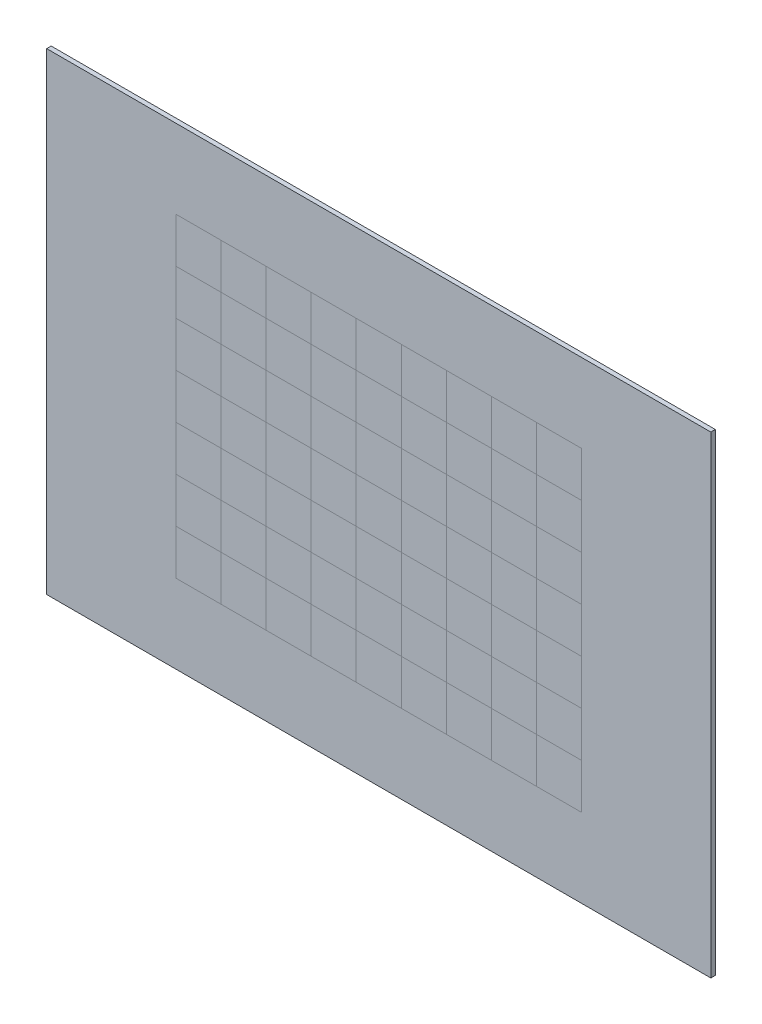
from build123d import *

# Parameters (mm, degrees)
SKETCH1_W           = 100
SKETCH1_H           = 100
BOSS_EXTRUDE1_DEPTH = 10
LPATTERN1_COUNT     = 9
LPATTERN1_PITCH     = 100
LPATTERN1_2_COUNT   = 7
LPATTERN1_2_PITCH   = 100
SKETCH2_W           = 1475
SKETCH2_H           = 1050
SKETCH2_W_2         = 900
SKETCH2_H_2         = 700
BOSS_EXTRUDE2_DEPTH = 10


with BuildPart() as part:
    # Sketch1 → Boss-Extrude1 (new body)
    with BuildSketch(Plane.XY):
        with Locations((50, -50)):
            Rectangle(SKETCH1_W, SKETCH1_H)
    extrude(amount=BOSS_EXTRUDE1_DEPTH)


with BuildPart() as lpattern1_1:
    # LPattern1: pattern copy
    add(part.part.moved(Location(Vector(1, 0, 0) * (1 * LPATTERN1_PITCH))))


with BuildPart() as lpattern1_2:
    # LPattern1: pattern copy
    add(part.part.moved(Location(Vector(1, 0, 0) * (2 * LPATTERN1_PITCH))))


with BuildPart() as lpattern1_3:
    # LPattern1: pattern copy
    add(part.part.moved(Location(Vector(1, 0, 0) * (3 * LPATTERN1_PITCH))))


with BuildPart() as lpattern1_4:
    # LPattern1: pattern copy
    add(part.part.moved(Location(Vector(1, 0, 0) * (4 * LPATTERN1_PITCH))))


with BuildPart() as lpattern1_5:
    # LPattern1: pattern copy
    add(part.part.moved(Location(Vector(1, 0, 0) * (5 * LPATTERN1_PITCH))))


with BuildPart() as lpattern1_6:
    # LPattern1: pattern copy
    add(part.part.moved(Location(Vector(1, 0, 0) * (6 * LPATTERN1_PITCH))))


with BuildPart() as lpattern1_7:
    # LPattern1: pattern copy
    add(part.part.moved(Location(Vector(1, 0, 0) * (7 * LPATTERN1_PITCH))))


with BuildPart() as lpattern1_8:
    # LPattern1: pattern copy
    add(part.part.moved(Location(Vector(1, 0, 0) * (8 * LPATTERN1_PITCH))))


with BuildPart() as lpattern1_2_1:
    # LPattern1 2: pattern copy
    add(part.part.moved(Location(Vector(0, -1, 0) * (1 * LPATTERN1_2_PITCH))))


with BuildPart() as lpattern1_2_2:
    # LPattern1 2: pattern copy
    add(part.part.moved(Location(Vector(0, -1, 0) * (2 * LPATTERN1_2_PITCH))))


with BuildPart() as lpattern1_2_3:
    # LPattern1 2: pattern copy
    add(part.part.moved(Location(Vector(0, -1, 0) * (3 * LPATTERN1_2_PITCH))))


with BuildPart() as lpattern1_2_4:
    # LPattern1 2: pattern copy
    add(part.part.moved(Location(Vector(0, -1, 0) * (4 * LPATTERN1_2_PITCH))))


with BuildPart() as lpattern1_2_5:
    # LPattern1 2: pattern copy
    add(part.part.moved(Location(Vector(0, -1, 0) * (5 * LPATTERN1_2_PITCH))))


with BuildPart() as lpattern1_2_6:
    # LPattern1 2: pattern copy
    add(part.part.moved(Location(Vector(0, -1, 0) * (6 * LPATTERN1_2_PITCH))))


with BuildPart() as lpattern1_2_7:
    # LPattern1 2: pattern copy
    add(lpattern1_1.part.moved(Location(Vector(0, -1, 0) * (1 * LPATTERN1_2_PITCH))))


with BuildPart() as lpattern1_2_8:
    # LPattern1 2: pattern copy
    add(lpattern1_1.part.moved(Location(Vector(0, -1, 0) * (2 * LPATTERN1_2_PITCH))))


with BuildPart() as lpattern1_2_9:
    # LPattern1 2: pattern copy
    add(lpattern1_1.part.moved(Location(Vector(0, -1, 0) * (3 * LPATTERN1_2_PITCH))))


with BuildPart() as lpattern1_2_10:
    # LPattern1 2: pattern copy
    add(lpattern1_1.part.moved(Location(Vector(0, -1, 0) * (4 * LPATTERN1_2_PITCH))))


with BuildPart() as lpattern1_2_11:
    # LPattern1 2: pattern copy
    add(lpattern1_1.part.moved(Location(Vector(0, -1, 0) * (5 * LPATTERN1_2_PITCH))))


with BuildPart() as lpattern1_2_12:
    # LPattern1 2: pattern copy
    add(lpattern1_1.part.moved(Location(Vector(0, -1, 0) * (6 * LPATTERN1_2_PITCH))))


with BuildPart() as lpattern1_2_13:
    # LPattern1 2: pattern copy
    add(lpattern1_2.part.moved(Location(Vector(0, -1, 0) * (1 * LPATTERN1_2_PITCH))))


with BuildPart() as lpattern1_2_14:
    # LPattern1 2: pattern copy
    add(lpattern1_2.part.moved(Location(Vector(0, -1, 0) * (2 * LPATTERN1_2_PITCH))))


with BuildPart() as lpattern1_2_15:
    # LPattern1 2: pattern copy
    add(lpattern1_2.part.moved(Location(Vector(0, -1, 0) * (3 * LPATTERN1_2_PITCH))))


with BuildPart() as lpattern1_2_16:
    # LPattern1 2: pattern copy
    add(lpattern1_2.part.moved(Location(Vector(0, -1, 0) * (4 * LPATTERN1_2_PITCH))))


with BuildPart() as lpattern1_2_17:
    # LPattern1 2: pattern copy
    add(lpattern1_2.part.moved(Location(Vector(0, -1, 0) * (5 * LPATTERN1_2_PITCH))))


with BuildPart() as lpattern1_2_18:
    # LPattern1 2: pattern copy
    add(lpattern1_2.part.moved(Location(Vector(0, -1, 0) * (6 * LPATTERN1_2_PITCH))))


with BuildPart() as lpattern1_2_19:
    # LPattern1 2: pattern copy
    add(lpattern1_3.part.moved(Location(Vector(0, -1, 0) * (1 * LPATTERN1_2_PITCH))))


with BuildPart() as lpattern1_2_20:
    # LPattern1 2: pattern copy
    add(lpattern1_3.part.moved(Location(Vector(0, -1, 0) * (2 * LPATTERN1_2_PITCH))))


with BuildPart() as lpattern1_2_21:
    # LPattern1 2: pattern copy
    add(lpattern1_3.part.moved(Location(Vector(0, -1, 0) * (3 * LPATTERN1_2_PITCH))))


with BuildPart() as lpattern1_2_22:
    # LPattern1 2: pattern copy
    add(lpattern1_3.part.moved(Location(Vector(0, -1, 0) * (4 * LPATTERN1_2_PITCH))))


with BuildPart() as lpattern1_2_23:
    # LPattern1 2: pattern copy
    add(lpattern1_3.part.moved(Location(Vector(0, -1, 0) * (5 * LPATTERN1_2_PITCH))))


with BuildPart() as lpattern1_2_24:
    # LPattern1 2: pattern copy
    add(lpattern1_3.part.moved(Location(Vector(0, -1, 0) * (6 * LPATTERN1_2_PITCH))))


with BuildPart() as lpattern1_2_25:
    # LPattern1 2: pattern copy
    add(lpattern1_4.part.moved(Location(Vector(0, -1, 0) * (1 * LPATTERN1_2_PITCH))))


with BuildPart() as lpattern1_2_26:
    # LPattern1 2: pattern copy
    add(lpattern1_4.part.moved(Location(Vector(0, -1, 0) * (2 * LPATTERN1_2_PITCH))))


with BuildPart() as lpattern1_2_27:
    # LPattern1 2: pattern copy
    add(lpattern1_4.part.moved(Location(Vector(0, -1, 0) * (3 * LPATTERN1_2_PITCH))))


with BuildPart() as lpattern1_2_28:
    # LPattern1 2: pattern copy
    add(lpattern1_4.part.moved(Location(Vector(0, -1, 0) * (4 * LPATTERN1_2_PITCH))))


with BuildPart() as lpattern1_2_29:
    # LPattern1 2: pattern copy
    add(lpattern1_4.part.moved(Location(Vector(0, -1, 0) * (5 * LPATTERN1_2_PITCH))))


with BuildPart() as lpattern1_2_30:
    # LPattern1 2: pattern copy
    add(lpattern1_4.part.moved(Location(Vector(0, -1, 0) * (6 * LPATTERN1_2_PITCH))))


with BuildPart() as lpattern1_2_31:
    # LPattern1 2: pattern copy
    add(lpattern1_5.part.moved(Location(Vector(0, -1, 0) * (1 * LPATTERN1_2_PITCH))))


with BuildPart() as lpattern1_2_32:
    # LPattern1 2: pattern copy
    add(lpattern1_5.part.moved(Location(Vector(0, -1, 0) * (2 * LPATTERN1_2_PITCH))))


with BuildPart() as lpattern1_2_33:
    # LPattern1 2: pattern copy
    add(lpattern1_5.part.moved(Location(Vector(0, -1, 0) * (3 * LPATTERN1_2_PITCH))))


with BuildPart() as lpattern1_2_34:
    # LPattern1 2: pattern copy
    add(lpattern1_5.part.moved(Location(Vector(0, -1, 0) * (4 * LPATTERN1_2_PITCH))))


with BuildPart() as lpattern1_2_35:
    # LPattern1 2: pattern copy
    add(lpattern1_5.part.moved(Location(Vector(0, -1, 0) * (5 * LPATTERN1_2_PITCH))))


with BuildPart() as lpattern1_2_36:
    # LPattern1 2: pattern copy
    add(lpattern1_5.part.moved(Location(Vector(0, -1, 0) * (6 * LPATTERN1_2_PITCH))))


with BuildPart() as lpattern1_2_37:
    # LPattern1 2: pattern copy
    add(lpattern1_6.part.moved(Location(Vector(0, -1, 0) * (1 * LPATTERN1_2_PITCH))))


with BuildPart() as lpattern1_2_38:
    # LPattern1 2: pattern copy
    add(lpattern1_6.part.moved(Location(Vector(0, -1, 0) * (2 * LPATTERN1_2_PITCH))))


with BuildPart() as lpattern1_2_39:
    # LPattern1 2: pattern copy
    add(lpattern1_6.part.moved(Location(Vector(0, -1, 0) * (3 * LPATTERN1_2_PITCH))))


with BuildPart() as lpattern1_2_40:
    # LPattern1 2: pattern copy
    add(lpattern1_6.part.moved(Location(Vector(0, -1, 0) * (4 * LPATTERN1_2_PITCH))))


with BuildPart() as lpattern1_2_41:
    # LPattern1 2: pattern copy
    add(lpattern1_6.part.moved(Location(Vector(0, -1, 0) * (5 * LPATTERN1_2_PITCH))))


with BuildPart() as lpattern1_2_42:
    # LPattern1 2: pattern copy
    add(lpattern1_6.part.moved(Location(Vector(0, -1, 0) * (6 * LPATTERN1_2_PITCH))))


with BuildPart() as lpattern1_2_43:
    # LPattern1 2: pattern copy
    add(lpattern1_7.part.moved(Location(Vector(0, -1, 0) * (1 * LPATTERN1_2_PITCH))))


with BuildPart() as lpattern1_2_44:
    # LPattern1 2: pattern copy
    add(lpattern1_7.part.moved(Location(Vector(0, -1, 0) * (2 * LPATTERN1_2_PITCH))))


with BuildPart() as lpattern1_2_45:
    # LPattern1 2: pattern copy
    add(lpattern1_7.part.moved(Location(Vector(0, -1, 0) * (3 * LPATTERN1_2_PITCH))))


with BuildPart() as lpattern1_2_46:
    # LPattern1 2: pattern copy
    add(lpattern1_7.part.moved(Location(Vector(0, -1, 0) * (4 * LPATTERN1_2_PITCH))))


with BuildPart() as lpattern1_2_47:
    # LPattern1 2: pattern copy
    add(lpattern1_7.part.moved(Location(Vector(0, -1, 0) * (5 * LPATTERN1_2_PITCH))))


with BuildPart() as lpattern1_2_48:
    # LPattern1 2: pattern copy
    add(lpattern1_7.part.moved(Location(Vector(0, -1, 0) * (6 * LPATTERN1_2_PITCH))))


with BuildPart() as lpattern1_2_49:
    # LPattern1 2: pattern copy
    add(lpattern1_8.part.moved(Location(Vector(0, -1, 0) * (1 * LPATTERN1_2_PITCH))))


with BuildPart() as lpattern1_2_50:
    # LPattern1 2: pattern copy
    add(lpattern1_8.part.moved(Location(Vector(0, -1, 0) * (2 * LPATTERN1_2_PITCH))))


with BuildPart() as lpattern1_2_51:
    # LPattern1 2: pattern copy
    add(lpattern1_8.part.moved(Location(Vector(0, -1, 0) * (3 * LPATTERN1_2_PITCH))))


with BuildPart() as lpattern1_2_52:
    # LPattern1 2: pattern copy
    add(lpattern1_8.part.moved(Location(Vector(0, -1, 0) * (4 * LPATTERN1_2_PITCH))))


with BuildPart() as lpattern1_2_53:
    # LPattern1 2: pattern copy
    add(lpattern1_8.part.moved(Location(Vector(0, -1, 0) * (5 * LPATTERN1_2_PITCH))))


with BuildPart() as lpattern1_2_54:
    # LPattern1 2: pattern copy
    add(lpattern1_8.part.moved(Location(Vector(0, -1, 0) * (6 * LPATTERN1_2_PITCH))))


with BuildPart() as body_64:
    # Sketch2 → Boss-Extrude2 (new body)
    with BuildSketch(Plane.XY):
        with Locations((450, -350)):
            Rectangle(SKETCH2_W, SKETCH2_H)
        with Locations((450, -350)):
            Rectangle(SKETCH2_W_2, SKETCH2_H_2, mode=Mode.SUBTRACT)
    extrude(amount=BOSS_EXTRUDE2_DEPTH)


solid = Compound([part.part, lpattern1_1.part, lpattern1_2.part, lpattern1_3.part, lpattern1_4.part, lpattern1_5.part, lpattern1_6.part, lpattern1_7.part, lpattern1_8.part, lpattern1_2_1.part, lpattern1_2_2.part, lpattern1_2_3.part, lpattern1_2_4.part, lpattern1_2_5.part, lpattern1_2_6.part, lpattern1_2_7.part, lpattern1_2_8.part, lpattern1_2_9.part, lpattern1_2_10.part, lpattern1_2_11.part, lpattern1_2_12.part, lpattern1_2_13.part, lpattern1_2_14.part, lpattern1_2_15.part, lpattern1_2_16.part, lpattern1_2_17.part, lpattern1_2_18.part, lpattern1_2_19.part, lpattern1_2_20.part, lpattern1_2_21.part, lpattern1_2_22.part, lpattern1_2_23.part, lpattern1_2_24.part, lpattern1_2_25.part, lpattern1_2_26.part, lpattern1_2_27.part, lpattern1_2_28.part, lpattern1_2_29.part, lpattern1_2_30.part, lpattern1_2_31.part, lpattern1_2_32.part, lpattern1_2_33.part, lpattern1_2_34.part, lpattern1_2_35.part, lpattern1_2_36.part, lpattern1_2_37.part, lpattern1_2_38.part, lpattern1_2_39.part, lpattern1_2_40.part, lpattern1_2_41.part, lpattern1_2_42.part, lpattern1_2_43.part, lpattern1_2_44.part, lpattern1_2_45.part, lpattern1_2_46.part, lpattern1_2_47.part, lpattern1_2_48.part, lpattern1_2_49.part, lpattern1_2_50.part, lpattern1_2_51.part, lpattern1_2_52.part, lpattern1_2_53.part, lpattern1_2_54.part, body_64.part])
